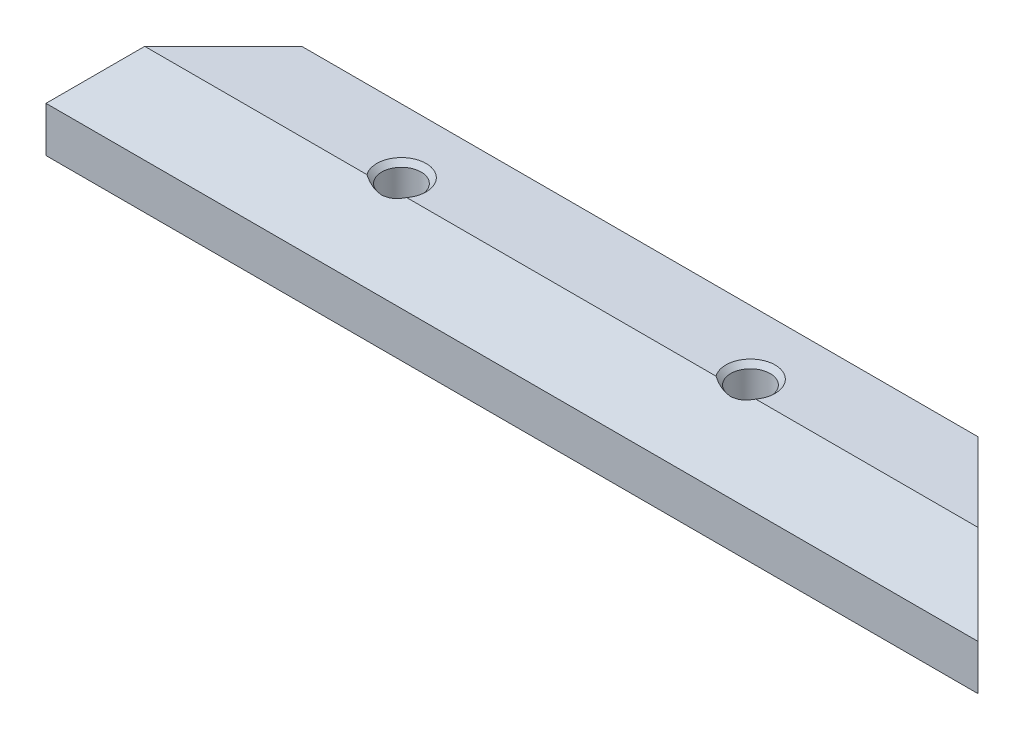
from build123d import *

# Parameters (mm, degrees)
BOSS_EXTRUDE1_DEPTH     = 3
BOSS_EXTRUDE2_DEPTH     = 12
BOSS_EXTRUDE3_DEPTH     = 4.17
CUT_EXTRUDE1_DEPTH      = 100.227239708
CUT_EXTRUDE1_DEPTH_BACK = 100.227239708
SKETCH3_R               = 2
CHAMFER1_SIZE           = 10
SKETCH8_R               = 4
CUT_EXTRUDE2_DEPTH      = 16.17
CHAMFER2_SIZE           = 1


with BuildPart() as part:
    # Sketch1 → Boss-Extrude1 (new body)
    with BuildSketch(Plane(origin=(0, 0, 0), x_dir=(1, 0, 0), z_dir=(0, 1, 0))):
        Polygon((-94.41, 0), (94.41, 0), (68.5, 25.91), (-68.5, 25.91), align=None)
    extrude(amount=BOSS_EXTRUDE1_DEPTH)

    # Sketch5 → Boss-Extrude2 (add)
    with BuildSketch(Plane(origin=(0, 3, 0), x_dir=(1, 0, 0), z_dir=(0, 1, 0))):
        with BuildLine():
            Line((-64.496944889, 25.91), (-68.5, 25.91))
            Line((-68.5, 25.91), (-94.41, 0))
            Line((-94.41, 0), (94.41, 0))
            Line((94.41, 0), (68.5, 25.91))
            Line((68.5, 25.91), (64.496944889, 25.91))
            ThreePointArc((64.496944889, 25.91), (54.829686624, 24.966540009), (45.527255216, 22.171764706))
            ThreePointArc((45.527255216, 22.171764706), (0, 13.2), (-45.527255216, 22.171764706))
            ThreePointArc((-45.527255216, 22.171764706), (-54.829686624, 24.966540009), (-64.496944889, 25.91))
        make_face()
    extrude(amount=BOSS_EXTRUDE2_DEPTH)

    # Sketch7 → Boss-Extrude3 (add)
    with BuildSketch(Plane(origin=(0, 15, 0), x_dir=(1, 0, 0), z_dir=(0, 1, 0))):
        Polygon((-94.41, 0), (-68.5, 25.91), (68.5, 25.91), (94.41, 0), align=None)
    extrude(amount=BOSS_EXTRUDE3_DEPTH)

    # Sketch3 → Cut-Extrude1 (cut, two sides: drawn at the far end of the back side and taken through both)
    with BuildSketch(Plane(origin=(0, 3, 0), x_dir=(1, 0, 0), z_dir=(0, 1, 0)).offset(-CUT_EXTRUDE1_DEPTH_BACK)):
        with Locations(Location((-35.355339059, 12.955, 0), (0, 0, 270))):
            Circle(SKETCH3_R)
        with Locations(Location((35.355339059, 12.955, 0), (0, 0, 270))):
            Circle(SKETCH3_R)
    extrude(amount=CUT_EXTRUDE1_DEPTH + CUT_EXTRUDE1_DEPTH_BACK, mode=Mode.SUBTRACT)

    # Chamfer1
    chamfer1_edges = [part.edges().sort_by_distance(p)[0] for p in [
        (0, 19.17, 0),
    ]]
    chamfer(chamfer1_edges, length=CHAMFER1_SIZE)

    # Sketch8 → Cut-Extrude2 (cut)
    with BuildSketch(Plane(origin=(0, 19.17, 0), x_dir=(1, 0, 0), z_dir=(0, 1, 0))):
        with Locations(Location((-35.355339059, 12.955, 0), (0, 0, 270))):
            Circle(SKETCH8_R)
        with Locations(Location((35.355339059, 12.955, 0), (0, 0, 270))):
            Circle(SKETCH8_R)
    extrude(amount=-CUT_EXTRUDE2_DEPTH, mode=Mode.SUBTRACT)

    # Chamfer2
    chamfer2_edges = [part.edges().sort_by_distance(p)[0] for p in [
        (-35.355339059, 19.17, -16.955),
        (35.355339059, 19.17, -16.955),
    ]]
    chamfer(chamfer2_edges, length=CHAMFER2_SIZE)


solid = part.part
